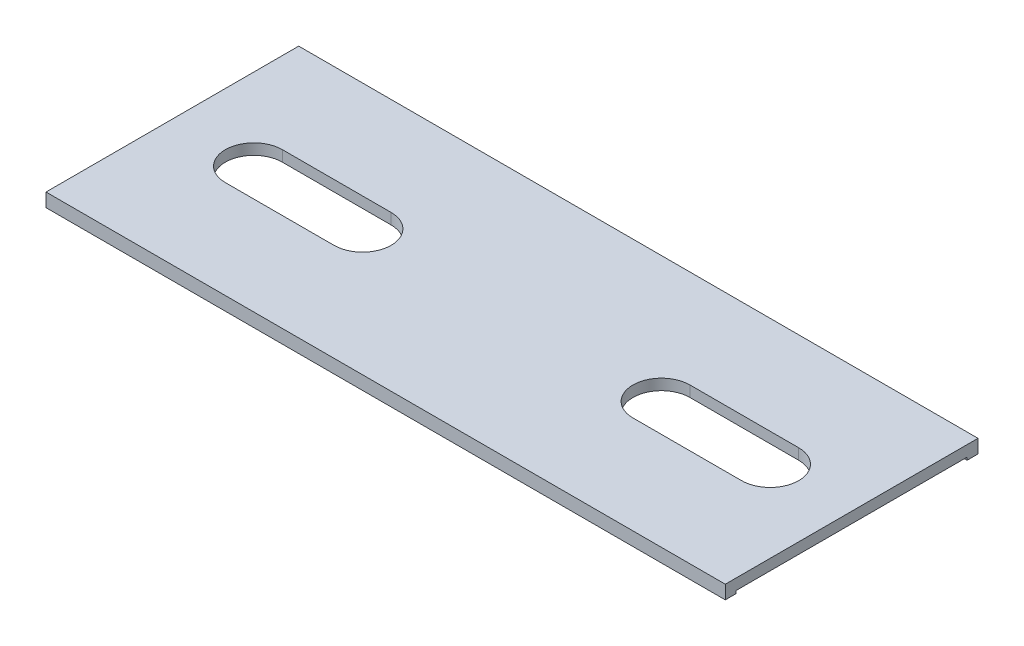
from build123d import *

# Parameters (mm, degrees)
BOSS_EXTRUDE1_DEPTH = 63.5
CUT_EXTRUDE1_DEPTH  = 68.763277548


with BuildPart() as part:
    # Sketch3 → Boss-Extrude1 (new body)
    with BuildSketch(Plane(origin=(0, 0, 0), x_dir=(0, 0, -1), z_dir=(1, 0, 0))):
        Polygon((0, 0), (23.622, 0), (23.622, -1.27), (22.606, -1.27), (22.606, -1.016), (1.016, -1.016), (1.016, -1.27), (0, -1.27), align=None)
    extrude(amount=BOSS_EXTRUDE1_DEPTH)

    # Sketch4 → Cut-Extrude1 (cut, through all)
    with BuildSketch(Plane(origin=(0, 0, 0), x_dir=(1, 0, 0), z_dir=(0, 1, 0))):
        with BuildLine():
            Line((7.62, 14.478), (17.78, 14.478))
            ThreePointArc((17.78, 14.478), (20.447, 11.811), (17.78, 9.144))
            Line((17.78, 9.144), (7.62, 9.144))
            ThreePointArc((7.62, 9.144), (4.953, 11.811), (7.62, 14.478))
        make_face()
        with BuildLine():
            Line((45.72, 9.144), (55.88, 9.144))
            ThreePointArc((55.88, 9.144), (58.547, 11.811), (55.88, 14.478))
            Line((55.88, 14.478), (45.72, 14.478))
            ThreePointArc((45.72, 14.478), (43.053, 11.811), (45.72, 9.144))
        make_face()
    extrude(amount=-CUT_EXTRUDE1_DEPTH, mode=Mode.SUBTRACT)


solid = part.part
